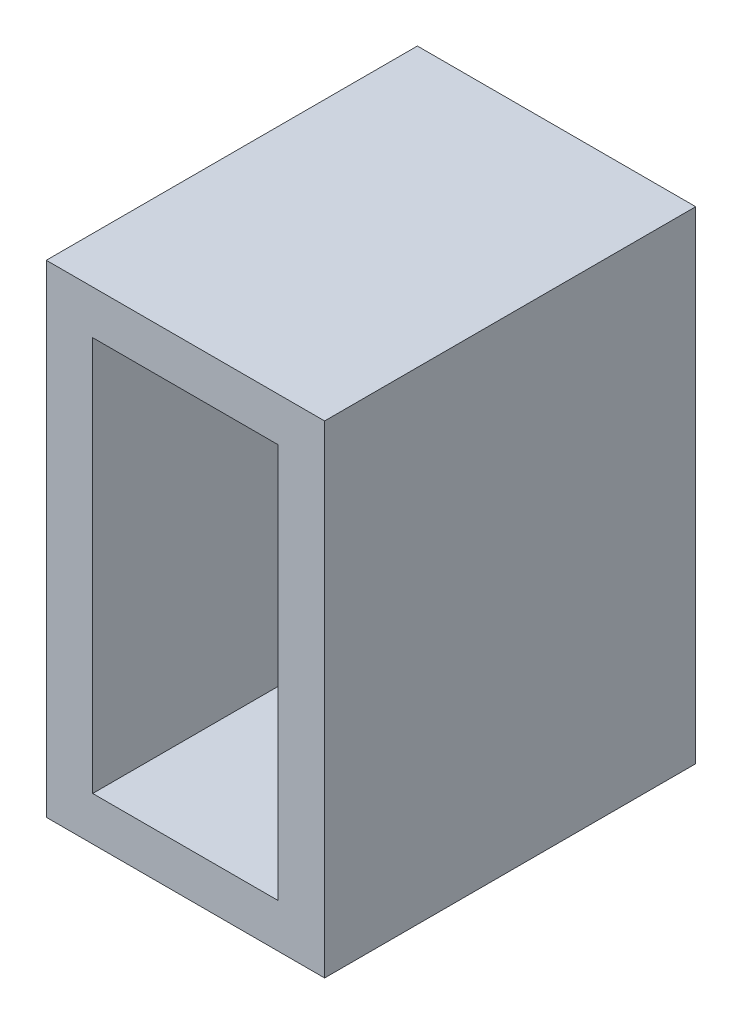
from build123d import *

# Parameters (mm, degrees)
SKETCH1_W           = 38.1
SKETCH1_H           = 66.04
SKETCH1_W_2         = 25.4
SKETCH1_H_2         = 54.0385
BOSS_EXTRUDE1_DEPTH = 50.8
SKETCH4_W           = 25.4
SKETCH4_H           = 7.08025
SKETCH4_W_2         = 2.921
SKETCH4_H_2         = 39.878
BOSS_EXTRUDE2_DEPTH = 2.54
SKETCH5_W           = 2.921
SKETCH5_H           = 54.0385
BOSS_EXTRUDE3_DEPTH = 5.588
SKETCH6_W           = 2.54
SKETCH6_H           = 7.08025
CUT_EXTRUDE1_DEPTH  = 2.54


with BuildPart() as part:
    # Sketch1 → Boss-Extrude1 (new body)
    with BuildSketch(Plane.XY):
        with Locations((4.108271787, 0.661591211)):
            Rectangle(SKETCH1_W, SKETCH1_H)
        with Locations((4.108271787, 0.661591211)):
            Rectangle(SKETCH1_W_2, SKETCH1_H_2, mode=Mode.SUBTRACT)
    extrude(amount=BOSS_EXTRUDE1_DEPTH)

    # Sketch4 → Boss-Extrude2 (add)
    with BuildSketch(Plane(origin=(0, 0, 5.588), x_dir=(-1, 0, 0), z_dir=(0, 0, -1))):
        with Locations((-4.108271787, 24.140716211)):
            Rectangle(SKETCH4_W, SKETCH4_H)
        with Locations((-15.347771787, 0.661591211)):
            Rectangle(SKETCH4_W_2, SKETCH4_H_2)
        with Locations((-4.108271787, -22.817533789)):
            Rectangle(SKETCH4_W, SKETCH4_H)
        with Locations((7.131228213, 0.661591211)):
            Rectangle(SKETCH4_W_2, SKETCH4_H_2)
    extrude(amount=-BOSS_EXTRUDE2_DEPTH)

    # Sketch5 → Boss-Extrude3 (add)
    with BuildSketch(Plane(origin=(0, 0, 5.588), x_dir=(-1, 0, 0), z_dir=(0, 0, -1))):
        with Locations((-15.347771787, 0.661591211)):
            Rectangle(SKETCH5_W, SKETCH5_H)
        with Locations((7.131228213, 0.661591211)):
            Rectangle(SKETCH5_W, SKETCH5_H)
    extrude(amount=BOSS_EXTRUDE3_DEPTH)

    # Sketch6 → Cut-Extrude1 (cut)
    with BuildSketch(Plane(origin=(0, 0, 5.588), x_dir=(-1, 0, 0), z_dir=(0, 0, -1))):
        with Locations((-4.108271787, 24.140716211)):
            Rectangle(SKETCH6_W, SKETCH6_H)
        with Locations((-4.108271787, -22.817533789)):
            Rectangle(SKETCH6_W, SKETCH6_H)
    extrude(amount=-CUT_EXTRUDE1_DEPTH, mode=Mode.SUBTRACT)


solid = part.part
